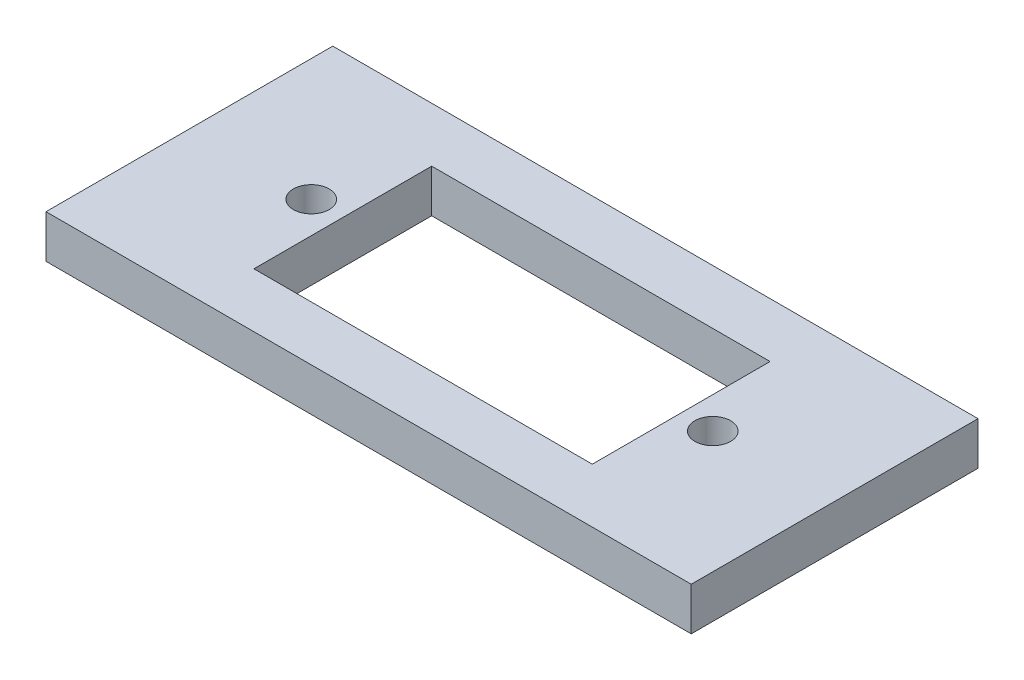
from build123d import *

# Parameters (mm, degrees)
CROQUIS1_W              = 45
CROQUIS1_H              = 20
CROQUIS1_R              = 1.25
CROQUIS1_W_2            = 23.6
CROQUIS1_H_2            = 12.4
SALIENTE_EXTRUIR1_DEPTH = 3


with BuildPart() as part:
    # Croquis1 → Saliente-Extruir1 (new body)
    with BuildSketch(Plane(origin=(0, 0, 0), x_dir=(1, 0, 0), z_dir=(0, 1, 0))):
        Rectangle(CROQUIS1_W, CROQUIS1_H)
        with Locations(Location((14, 0, 0), (0, 0, 270))):
            Circle(CROQUIS1_R, mode=Mode.SUBTRACT)
        with Locations(Location((-14, 0, 0), (0, 0, 270))):
            Circle(CROQUIS1_R, mode=Mode.SUBTRACT)
        Rectangle(CROQUIS1_W_2, CROQUIS1_H_2, mode=Mode.SUBTRACT)
    extrude(amount=SALIENTE_EXTRUIR1_DEPTH)


solid = part.part
